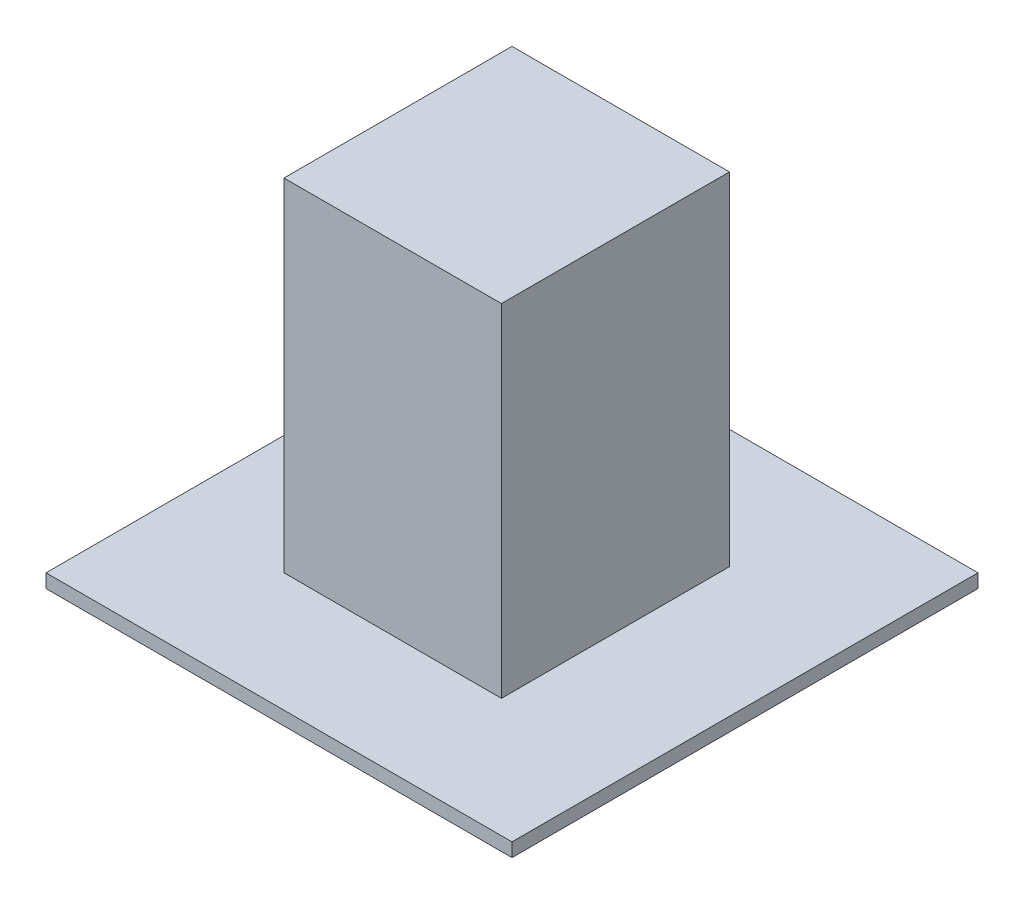
from build123d import *

# Parameters (mm, degrees)
SKETCH_1_W          = 136.3
SKETCH_1_H          = 136.3
EXTRUDE_1_DEPTH     = 4
EXTRUDE_2_DEPTH     = 100
CUT_EXTRUDE_1_DEPTH = 100
SKETCH_4_W          = 60.5
SKETCH_4_H          = 100
EXTRUDE_3_DEPTH     = 60.5


with BuildPart() as part:
    # 草图1 → 凸台-拉伸1 (new body)
    with BuildSketch(Plane(origin=(0, 0, 0), x_dir=(1, 0, 0), z_dir=(0, 1, 0))):
        Rectangle(SKETCH_1_W, SKETCH_1_H)
    extrude(amount=EXTRUDE_1_DEPTH)

    # 草图2 → 凸台-拉伸2 (add)
    with BuildSketch(Plane(origin=(0, 4, 0), x_dir=(1, 0, 0), z_dir=(0, 1, 0))):
        Polygon((30.25, 30.25), (-30.25, 30.25), (-30.25, -30.25), (30.25, -30.25), (30.25, -33.35), (-33.35, -33.35), (-33.35, -1.55), (-63.85, -1.55), (-63.85, 1.55), (-33.35, 1.55), (-33.35, 33.35), (30.25, 33.35), align=None)
    extrude(amount=EXTRUDE_2_DEPTH)

    # 草图3 → 切除-拉伸1 (cut)
    with BuildSketch(Plane.XY.offset(1.55)):
        Polygon((-63.85, 4), (-33.35, 72), (-33.35, 104), (-63.85, 104), align=None)
    extrude(amount=-CUT_EXTRUDE_1_DEPTH, mode=Mode.SUBTRACT)

    # 草图4 → 凸台-拉伸3 (add)
    with BuildSketch(Plane(origin=(-30.25, 0, 0), x_dir=(0, 0, -1), z_dir=(1, 0, 0))):
        with Locations((0, 54)):
            Rectangle(SKETCH_4_W, SKETCH_4_H)
    extrude(amount=EXTRUDE_3_DEPTH)


solid = part.part
